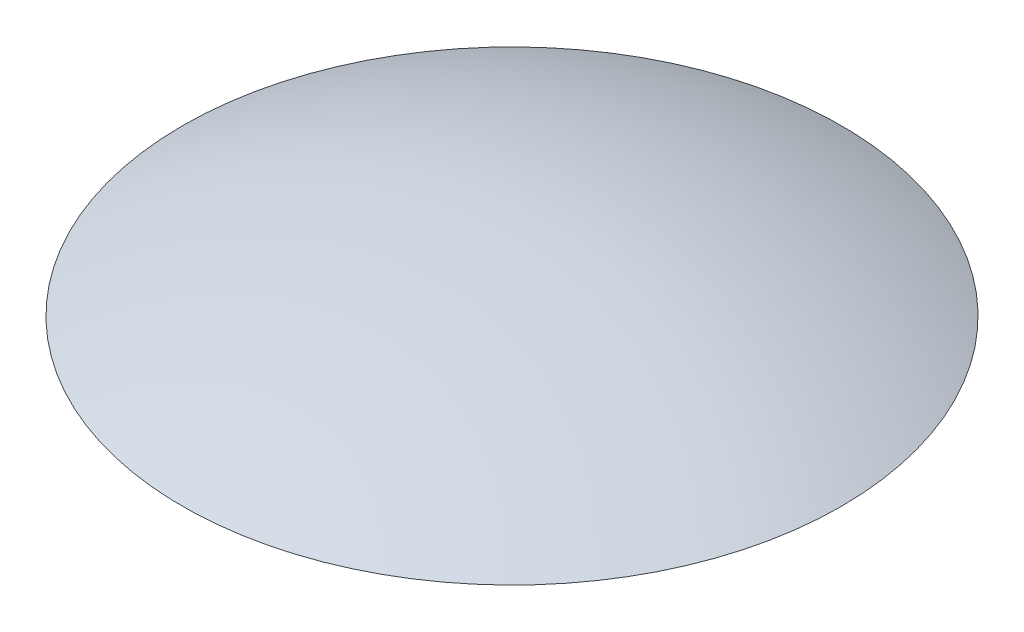
from build123d import *

# Parameters (mm, degrees)
ESQUISSE4_R                  = 10.25
ENL_V_MAT_EXTRU_2_DEPTH      = 11.65
ESQUISSE5_R                  = 10
ENL_V_MAT_EXTRU_3_DEPTH      = 6
R_P_TITION_CIRCULAIRE1_COUNT = 3


with BuildPart() as part:
    # Esquisse1 → Révolution1 (revolve)
    with BuildSketch(Plane.XY):
        with BuildLine():
            Line((0, 15), (0, 0))
            Line((0, 0), (65.383484153, 0))
            ThreePointArc((65.383484153, 0), (33.541019662, 11.201915172), (0, 15))
        make_face()
    revolve(axis=Axis((0, 15, 0), (0, -1, 0)))

    # Esquisse4 → Enlèv. mat.-Extru.2 (cut)
    with BuildSketch(Plane.XZ):
        Circle(ESQUISSE4_R)
    extrude(amount=-ENL_V_MAT_EXTRU_2_DEPTH, mode=Mode.SUBTRACT)

    # Esquisse5 → Enlèv. mat.-Extru.3 (cut)
    with BuildSketch(Plane.XZ):
        with Locations((35, 0)):
            Circle(ESQUISSE5_R)
    enl_v_mat_extru_3 = extrude(amount=-ENL_V_MAT_EXTRU_3_DEPTH, mode=Mode.SUBTRACT)

    # Répétition circulaire1: Enlèv. mat.-Extru.3 ×3 about axis
    r_p_tition_circulaire1_axis = Axis((0, 0, 0), (0, 1, 0))
    for i in range(1, R_P_TITION_CIRCULAIRE1_COUNT):
        add(enl_v_mat_extru_3.rotate(r_p_tition_circulaire1_axis, i * 360 / R_P_TITION_CIRCULAIRE1_COUNT), mode=Mode.SUBTRACT)


solid = part.part
